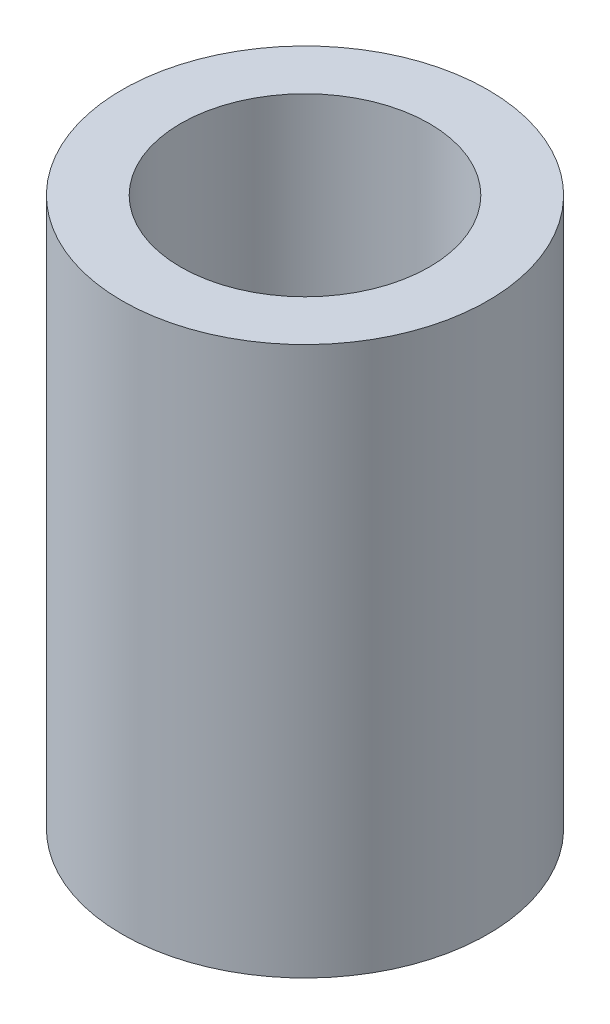
from build123d import *

# Parameters (mm, degrees)
SKETCH1_R           = 4.7625
SKETCH1_R_2         = 3.2385
BOSS_EXTRUDE1_DEPTH = 7.14375


with BuildPart() as part:
    # Sketch1 → Boss-Extrude1 (new, symmetric)
    with BuildSketch(Plane(origin=(0, 0, 0), x_dir=(1, 0, 0), z_dir=(0, 1, 0))):
        with Locations(Location((0, 0, 0), (0, 0, 270))):
            Circle(SKETCH1_R)
        with Locations(Location((0, 0, 0), (0, 0, 270))):
            Circle(SKETCH1_R_2, mode=Mode.SUBTRACT)
    extrude(amount=BOSS_EXTRUDE1_DEPTH, both=True)


solid = part.part
